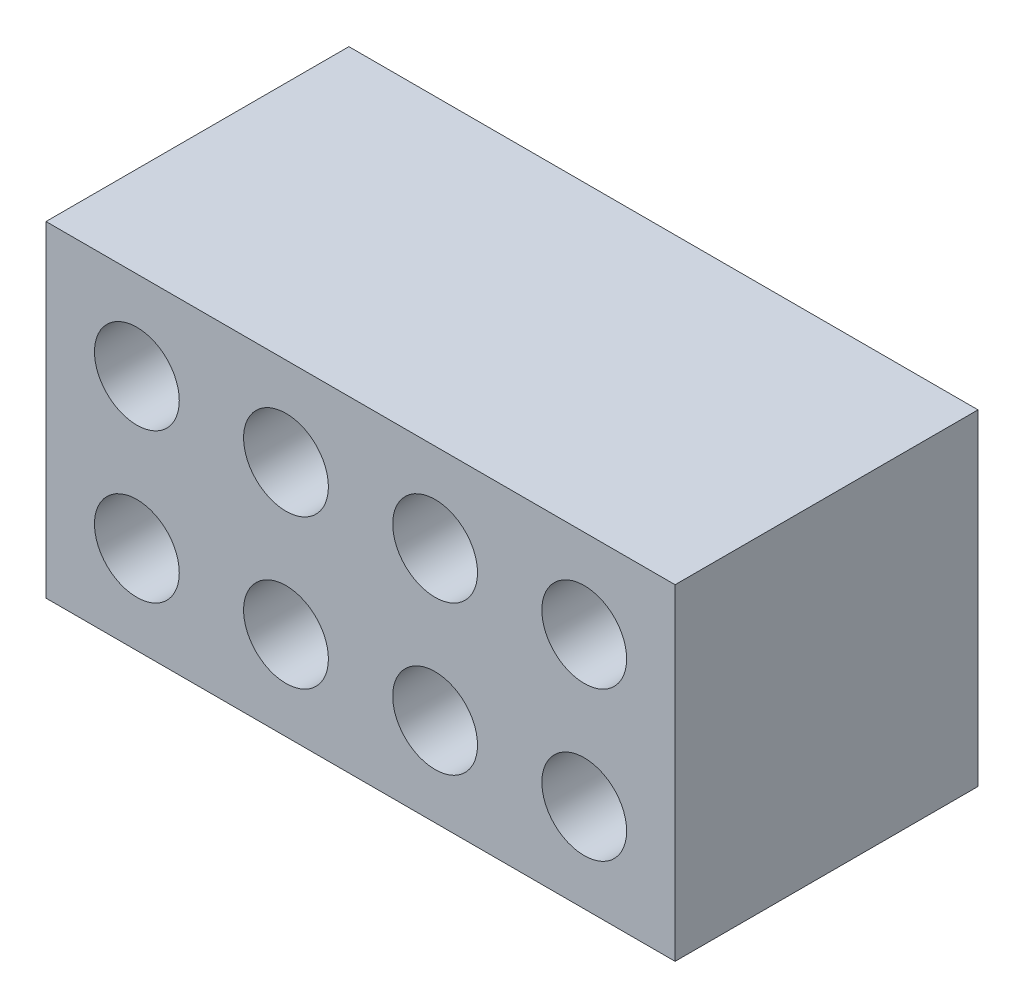
from build123d import *

# Parameters (mm, degrees)
SKETCH1_W           = 135
SKETCH1_H           = 70
BOSS_EXTRUDE1_DEPTH = 65
SKETCH2_R           = 9.1
CUT_EXTRUDE1_DEPTH  = 66


with BuildPart() as part:
    # Sketch1 → Boss-Extrude1 (new body)
    with BuildSketch(Plane.XY):
        Rectangle(SKETCH1_W, SKETCH1_H)
    extrude(amount=BOSS_EXTRUDE1_DEPTH)

    # Sketch2 → Cut-Extrude1 (cut)
    with BuildSketch(Plane.XY.offset(65)):
        with Locations((-48, -16)):
            Circle(SKETCH2_R)
        with Locations((-16, -16)):
            Circle(SKETCH2_R)
        with Locations((16, -16)):
            Circle(SKETCH2_R)
        with Locations((48, -16)):
            Circle(SKETCH2_R)
        with Locations((-48, 16)):
            Circle(SKETCH2_R)
        with Locations((-16, 16)):
            Circle(SKETCH2_R)
        with Locations((16, 16)):
            Circle(SKETCH2_R)
        with Locations((48, 16)):
            Circle(SKETCH2_R)
    extrude(amount=-CUT_EXTRUDE1_DEPTH, mode=Mode.SUBTRACT)


solid = part.part
